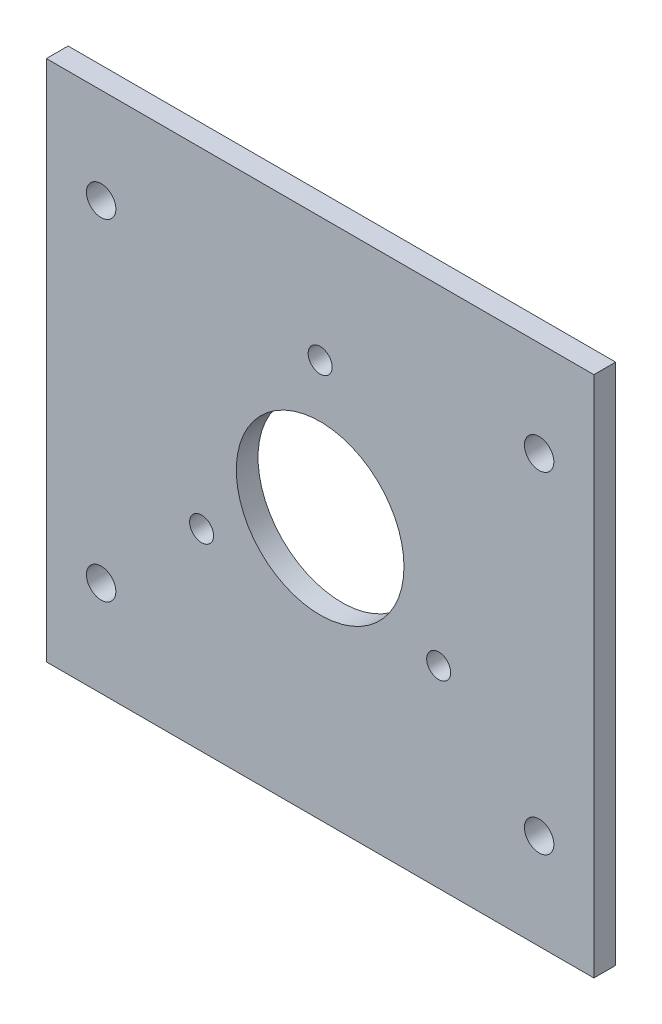
from build123d import *

# Parameters (mm, degrees)
SKETCH1_W           = 80
SKETCH1_H           = 76.35
SKETCH1_R           = 1.75
SKETCH1_R_2         = 12.25
SKETCH1_R_3         = 2.15
BOSS_EXTRUDE1_DEPTH = 3.175


with BuildPart() as part:
    # Sketch1 → Boss-Extrude1 (new body)
    with BuildSketch(Plane.XY):
        Rectangle(SKETCH1_W, SKETCH1_H)
        with Locations((0, 20)):
            Circle(SKETCH1_R, mode=Mode.SUBTRACT)
        Circle(SKETCH1_R_2, mode=Mode.SUBTRACT)
        with Locations((17.320508076, -10)):
            Circle(SKETCH1_R, mode=Mode.SUBTRACT)
        with Locations((-17.320508076, -10)):
            Circle(SKETCH1_R, mode=Mode.SUBTRACT)
        with Locations((-32, 24.2)):
            Circle(SKETCH1_R_3, mode=Mode.SUBTRACT)
        with Locations(Location((32, 24.2, 0), (0, 0, 180))):
            Circle(SKETCH1_R_3, mode=Mode.SUBTRACT)
        with Locations((32, -24.2)):
            Circle(SKETCH1_R_3, mode=Mode.SUBTRACT)
        with Locations(Location((-32, -24.2, 0), (0, 0, 180))):
            Circle(SKETCH1_R_3, mode=Mode.SUBTRACT)
    extrude(amount=BOSS_EXTRUDE1_DEPTH)


solid = part.part
